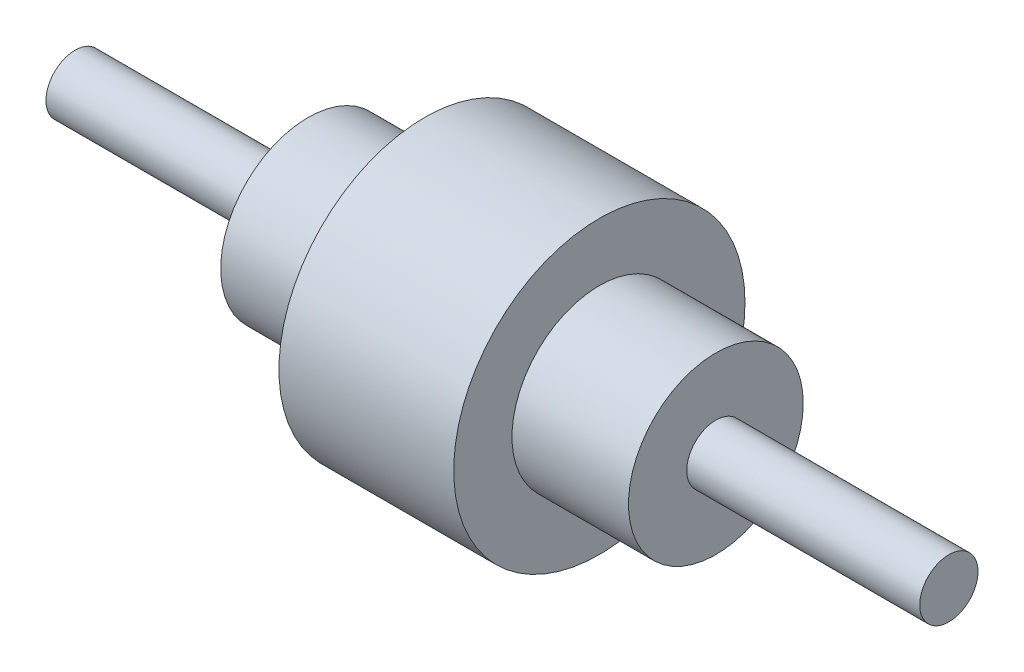
from build123d import *


with BuildPart() as part:
    # Croquis1 → Revolución1 (revolve)
    with BuildSketch(Plane.XY, mode=Mode.PRIVATE) as revoluci_n1_sk:
        Polygon((150, 0), (150, 10), (70, 10), (70, 30), (30, 30), (30, 50), (-30, 50), (-30, 30), (-70, 30), (-70, 10), (-150, 10), (-150, 0), align=None)
    revolve(revoluci_n1_sk.sketch.rotate(Axis((150, 0, 0), (-1, 0, 0)), 90), axis=Axis((150, 0, 0), (-1, 0, 0)))


solid = part.part
